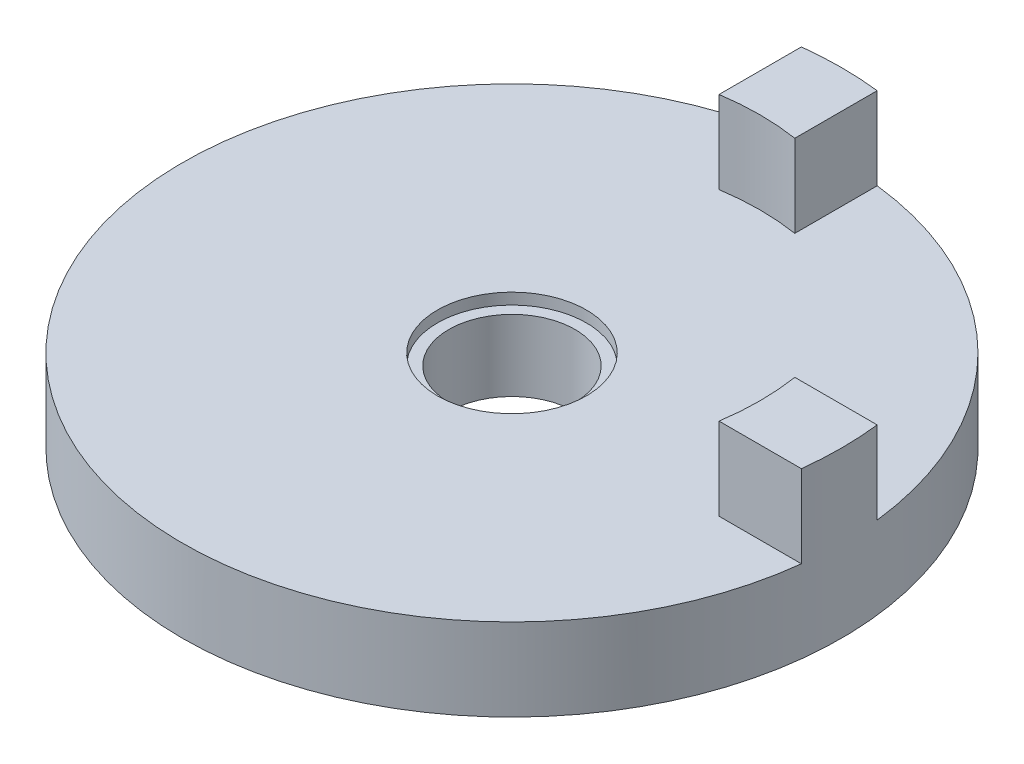
from build123d import *

# Parameters (mm, degrees)
SKETCH1_R           = 25.4
BOSS_EXTRUDE1_DEPTH = 6.35
SKETCH2_R           = 4.8641
CUT_EXTRUDE1_DEPTH  = 37.477972806
SKETCH3_R           = 5.7404
CUT_EXTRUDE3_DEPTH  = 0.8636
BOSS_EXTRUDE2_DEPTH = 6.35


with BuildPart() as part:
    # Sketch1 → Boss-Extrude1 (new body)
    with BuildSketch(Plane(origin=(0, 0, 0), x_dir=(1, 0, 0), z_dir=(0, 1, 0))):
        with Locations(Location((0, 0, 0), (0, 0, 270))):
            Circle(SKETCH1_R)
    extrude(amount=BOSS_EXTRUDE1_DEPTH)

    # Sketch2 → Cut-Extrude1 (cut, through all)
    with BuildSketch(Plane(origin=(0, 6.35, 0), x_dir=(1, 0, 0), z_dir=(0, 1, 0))):
        with Locations(Location((0, 0, 0), (0, 0, 270))):
            Circle(SKETCH2_R)
    extrude(amount=-CUT_EXTRUDE1_DEPTH, mode=Mode.SUBTRACT)

    # Sketch3 → Cut-Extrude3 (cut)
    with BuildSketch(Plane(origin=(0, 6.35, 0), x_dir=(1, 0, 0), z_dir=(0, 1, 0))):
        with Locations(Location((0, 0, 0), (0, 0, 270))):
            Circle(SKETCH3_R)
    extrude(amount=-CUT_EXTRUDE3_DEPTH, mode=Mode.SUBTRACT)

    # Sketch4 → Boss-Extrude2 (add)
    with BuildSketch(Plane(origin=(0, 6.35, 0), x_dir=(1, 0, 0), z_dir=(0, 1, 0))):
        with BuildLine():
            Line((2.921, 18.881483488), (2.921, 25.231483488))
            ThreePointArc((2.921, 25.231483488), (0, 25.4), (-2.921, 25.231483488))
            Line((-2.921, 25.231483488), (-2.921, 18.881483488))
            ThreePointArc((-2.921, 18.881483488), (0, 19.106089597), (2.921, 18.881483488))
        make_face()
        with BuildLine():
            Line((25.231483488, 2.921), (18.881483488, 2.921))
            ThreePointArc((18.881483488, 2.921), (19.106089597, 0), (18.881483488, -2.921))
            Line((18.881483488, -2.921), (25.231483488, -2.921))
            ThreePointArc((25.231483488, -2.921), (25.357835876, -1.462928468), (25.4, 0))
            ThreePointArc((25.4, 0), (25.357835876, 1.462928468), (25.231483488, 2.921))
        make_face()
    extrude(amount=BOSS_EXTRUDE2_DEPTH)


solid = part.part
